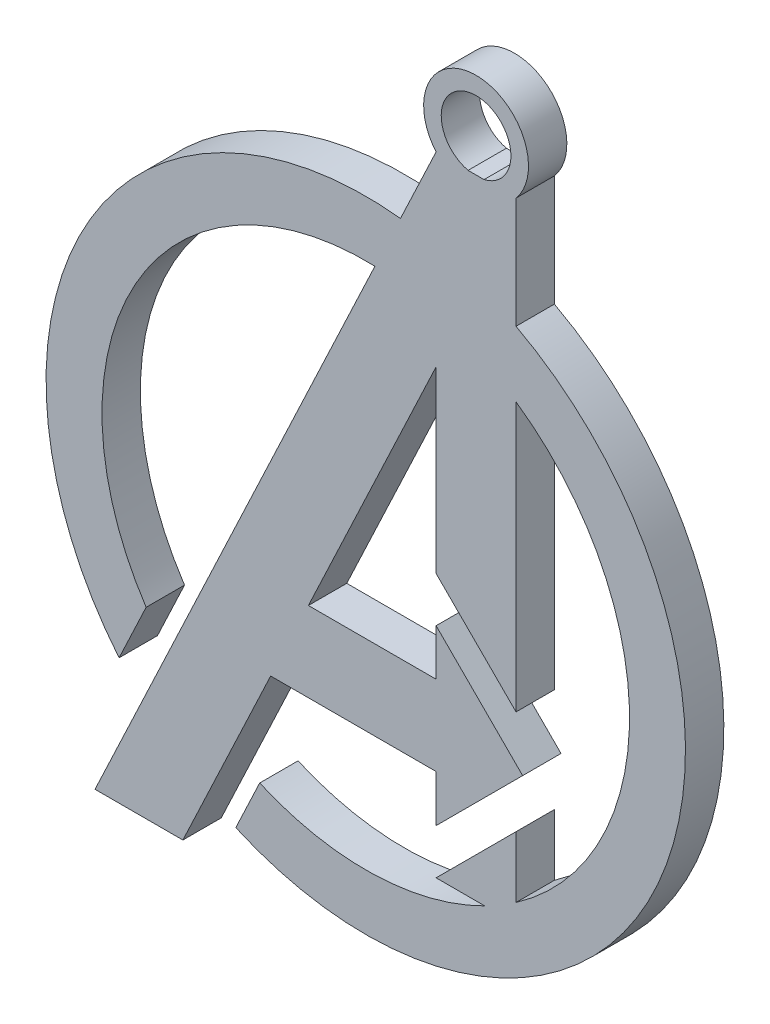
from build123d import *

# Parameters (mm, degrees)
SKETCH2_R           = 25.4
SKETCH2_R_2         = 20.955
BOSS_EXTRUDE1_DEPTH = 3.048
SKETCH3_W           = 6.35
SKETCH3_H           = 49.944808163
BOSS_EXTRUDE2_DEPTH = 3.048
CUT_EXTRUDE1_DEPTH  = 3.302
BOSS_EXTRUDE3_DEPTH = 3.048
CUT_EXTRUDE2_DEPTH  = 3.048
SKETCH12_W          = 13.143188689
SKETCH12_H          = 6.35
BOSS_EXTRUDE5_DEPTH = 3.048
SKETCH6_W           = 27.175313858
SKETCH6_H           = 4.151974609
CUT_EXTRUDE4_DEPTH  = 3.048
BOSS_EXTRUDE6_DEPTH = 3.048


with BuildPart() as part:
    # Sketch2 → Boss-Extrude1 (new body)
    with BuildSketch(Plane.XY):
        Circle(SKETCH2_R)
        Circle(SKETCH2_R_2, mode=Mode.SUBTRACT)
    extrude(amount=BOSS_EXTRUDE1_DEPTH)

    # Sketch3 → Boss-Extrude2 (add)
    with BuildSketch(Plane.XY):
        with Locations((8.763, 6.269595919)):
            Rectangle(SKETCH3_W, SKETCH3_H)
    extrude(amount=BOSS_EXTRUDE2_DEPTH)

    # Sketch8 → Cut-Extrude1 (cut)
    with BuildSketch(Plane.XY):
        Polygon((-11.882255203, 0.183619794), (-24.319009678, -26.162), (-14.01620416, -31.025558483), (-1.579449685, -4.679938689), align=None)
    extrude(amount=CUT_EXTRUDE1_DEPTH, mode=Mode.SUBTRACT)

    # Sketch7 → Boss-Extrude3 (add)
    with BuildSketch(Plane.XY):
        Polygon((5.588, 31.242), (-21.510222, -26.162), (-15.801284542, -28.856969943), (11.296937458, 28.547030057), align=None)
    extrude(amount=BOSS_EXTRUDE3_DEPTH)

    # Sketch9 → Cut-Extrude2 (cut)
    with BuildSketch(Plane.XY):
        Polygon((5.588, -18.702808163), (5.588, 2.236396155), (16.057602159, -8.233206004), align=None)
    extrude(amount=CUT_EXTRUDE2_DEPTH, mode=Mode.SUBTRACT)

    # Sketch12 → Boss-Extrude5 (add)
    with BuildSketch(Plane.XY):
        Polygon((5.588, -15.110705714), (5.588, -1.355706294), (12.46549971, -8.233206004), align=None)
        with Locations((-0.983594345, -8.213706294)):
            Rectangle(SKETCH12_W, SKETCH12_H)
    extrude(amount=BOSS_EXTRUDE5_DEPTH)

    # Sketch6 → Cut-Extrude4 (cut)
    with BuildSketch(Plane.XY):
        with Locations((-13.587656929, -28.237987305)):
            Rectangle(SKETCH6_W, SKETCH6_H)
    extrude(amount=CUT_EXTRUDE4_DEPTH, mode=Mode.SUBTRACT)

    # Sketch13 → Boss-Extrude6 (add)
    with BuildSketch(Plane.XY):
        with BuildLine():
            Line((5.588, 31.242), (8.128, 31.242))
            ThreePointArc((8.128, 31.242), (8.763, 36.706884628), (9.398, 31.242))
            Line((9.398, 31.242), (11.938, 31.242))
            ThreePointArc((11.938, 31.242), (8.763, 38.102476668), (5.588, 31.242))
        make_face()
    extrude(amount=BOSS_EXTRUDE6_DEPTH)


solid = part.part
